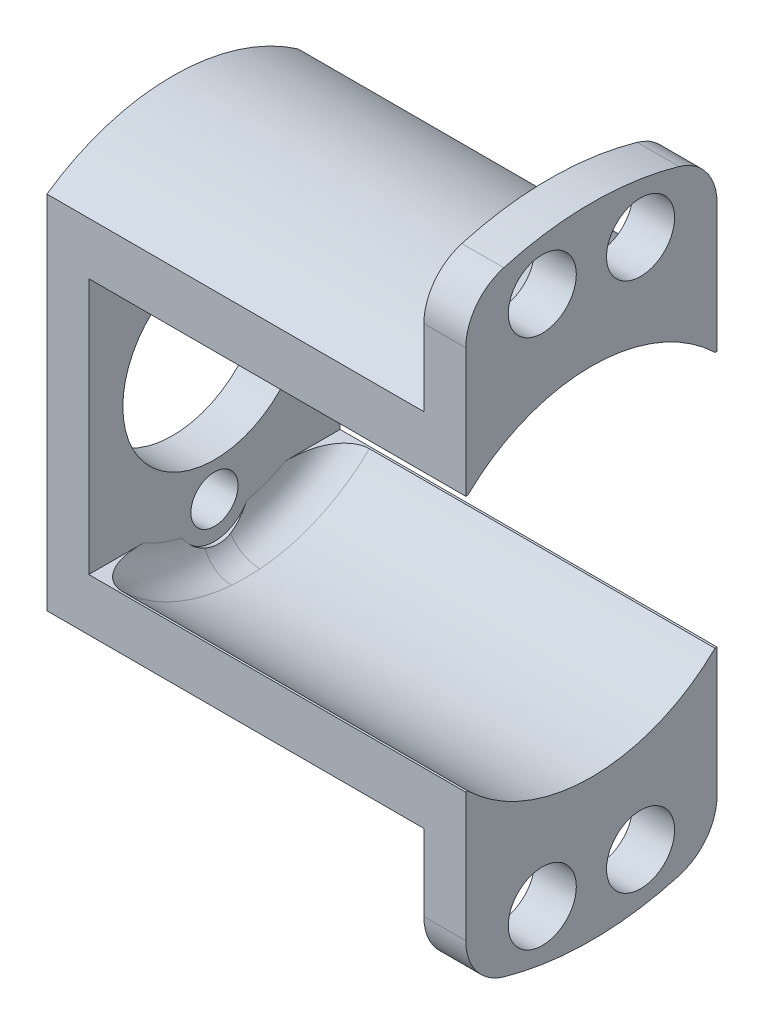
from build123d import *

# Parameters (mm, degrees)
SKETCH2_R               = 3.25
BOSS_EXTRUDE1_DEPTH     = 4
CIRPATTERN2_COUNT       = 2
CUT_EXTRUDE4_DEPTH      = 53.060061468
CUT_EXTRUDE4_DEPTH_BACK = 53.060061468
SKETCH6_W               = 12.790505544
SKETCH6_H               = 56.080299572
SKETCH6_W_2             = 13.13165929
CUT_EXTRUDE5_DEPTH      = 56.733742024
CUT_EXTRUDE5_DEPTH_BACK = 56.733742024
SKETCH8_R               = 2.25
CUT_EXTRUDE6_DEPTH      = 10
FILLET1_R               = 3
SKETCH9_R               = 3.5
CUT_EXTRUDE7_DEPTH      = 30
FILLET2_R               = 5


with BuildPart() as part:
    # Sketch1 → Revolve1 (revolve)
    with BuildSketch(Plane.XY, mode=Mode.PRIVATE) as revolve1_sk:
        Polygon((0, 8.75), (0, 21), (36, 21), (36, 22), (40, 22), (40, 17), (4, 17), (4, 8.75), align=None)
    revolve(revolve1_sk.sketch.rotate(Axis((0, 0, 0), (1, 0, 0)), 90), axis=Axis((0, 0, 0), (1, 0, 0)))

    # Sketch2 → Boss-Extrude1 (add)
    with BuildSketch(Plane(origin=(40, 0, 0), x_dir=(0, 0, -1), z_dir=(1, 0, 0))):
        with BuildLine():
            Line((12, 28.040149786), (12, 18.439088915))
            ThreePointArc((12, 18.439088915), (0, 22), (-12, 18.439088915))
            Line((-12, 18.439088915), (-12, 28.040149786))
            ThreePointArc((-12, 28.040149786), (0, 30.5), (12, 28.040149786))
        make_face()
        with Locations((-4.692554767, 25.318815726)):
            Circle(SKETCH2_R, mode=Mode.SUBTRACT)
        with Locations((4.692554767, 25.318815726)):
            Circle(SKETCH2_R, mode=Mode.SUBTRACT)
    boss_extrude1 = extrude(amount=-BOSS_EXTRUDE1_DEPTH)

    # CirPattern2: Boss-Extrude1 ×2 about axis
    cirpattern2_axis = Axis((0, 0, 0), (1, 0, 0))
    for i in range(1, CIRPATTERN2_COUNT):
        add(boss_extrude1.rotate(cirpattern2_axis, i * 360 / CIRPATTERN2_COUNT))

    # Sketch6 → Cut-Extrude4 (cut, two sides: drawn at the far end of the back side and taken through both)
    with BuildSketch(Plane.ZY.offset(-36).offset(-CUT_EXTRUDE4_DEPTH_BACK)):
        with Locations((-18.395252772, 0)):
            Rectangle(SKETCH6_W, SKETCH6_H)
        with Locations((18.565829645, 0)):
            Rectangle(SKETCH6_W_2, SKETCH6_H)
    extrude(amount=CUT_EXTRUDE4_DEPTH + CUT_EXTRUDE4_DEPTH_BACK, mode=Mode.SUBTRACT)

    # Sketch7 → Cut-Extrude5 (cut, two sides: drawn at the far end of the back side and taken through both)
    with BuildSketch(Plane.XY.offset(12).offset(-CUT_EXTRUDE5_DEPTH_BACK)):
        Polygon((40, 0), (40, 12.23368794), (4, 12.23368794), (4, -12.23368794), (40, -12.23368794), align=None)
    extrude(amount=CUT_EXTRUDE5_DEPTH + CUT_EXTRUDE5_DEPTH_BACK, mode=Mode.SUBTRACT)

    # Sketch8 → Cut-Extrude6 (cut)
    with BuildSketch(Plane.ZY):
        with Locations((0, -12)):
            Circle(SKETCH8_R)
        with Locations((0, 12)):
            Circle(SKETCH8_R)
    extrude(amount=-CUT_EXTRUDE6_DEPTH, mode=Mode.SUBTRACT)

    # Fillet1
    fillet1_edges = [part.edges().sort_by_distance(p)[0] for p in [
        (4, -17, 0),
        (4, 17, 0),
    ]]
    fillet(fillet1_edges, radius=FILLET1_R)

    # Sketch9 → Cut-Extrude7 (cut)
    with BuildSketch(Plane(origin=(4, 0, 0), x_dir=(0, 0, -1), z_dir=(1, 0, 0))):
        with Locations((0, 12)):
            Circle(SKETCH9_R)
        with Locations((0, -12)):
            Circle(SKETCH9_R)
    extrude(amount=CUT_EXTRUDE7_DEPTH, mode=Mode.SUBTRACT)

    # Fillet2
    fillet2_edges = [part.edges().sort_by_distance(p)[0] for p in [
        (38, 28.040149786, -12),
        (38, 28.040149786, 12),
        (38, -28.040149786, 12),
        (38, -28.040149786, -12),
    ]]
    fillet(fillet2_edges, radius=FILLET2_R)


solid = part.part
